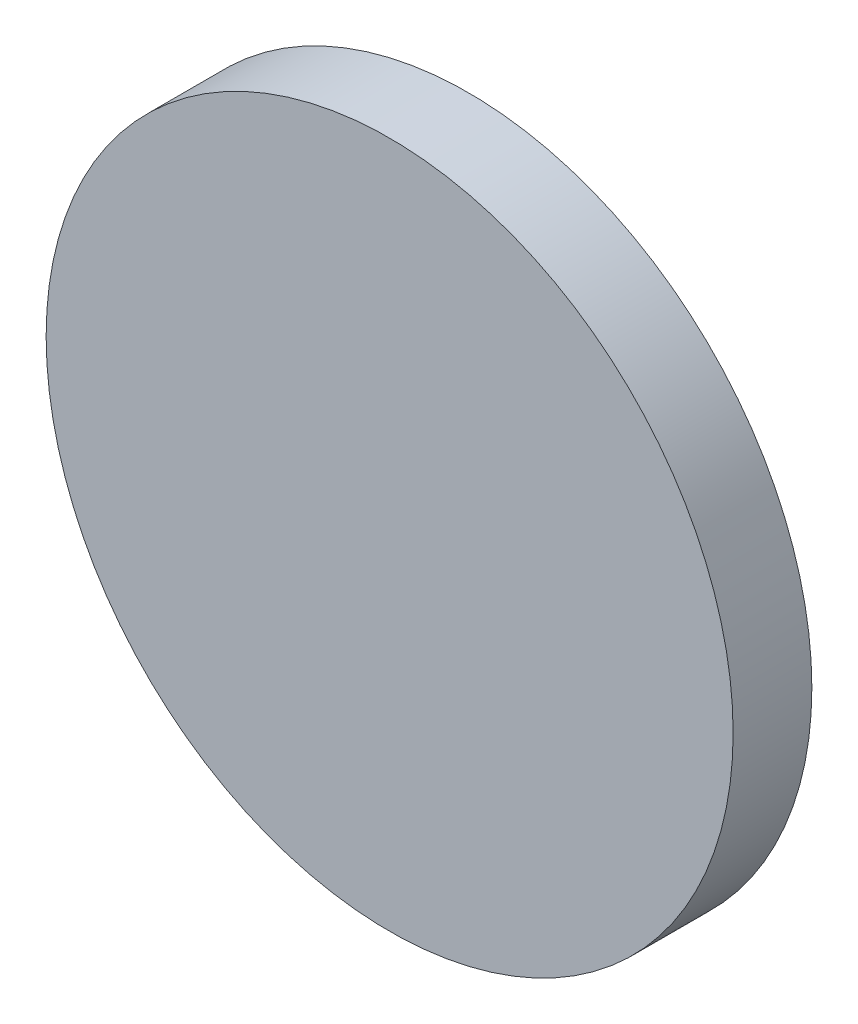
from build123d import *

# Parameters (mm, degrees)
SKETCH1_R           = 43.632619137
BOSS_EXTRUDE1_DEPTH = 10


with BuildPart() as part:
    # Sketch1 → Boss-Extrude1 (new body)
    with BuildSketch(Plane.XY):
        Circle(SKETCH1_R)
    extrude(amount=BOSS_EXTRUDE1_DEPTH)


solid = part.part
